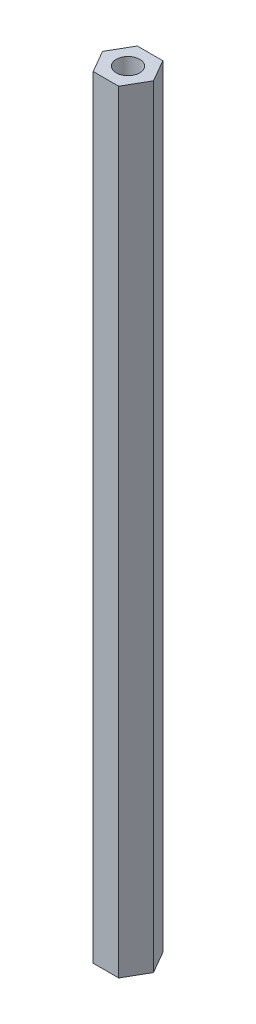
from build123d import *

# Parameters (mm, degrees)
SKETCH_1_R      = 1.6
EXTRUDE_1_DEPTH = 105


with BuildPart() as part:
    # 草图1 → 凸台-拉伸1 (new body)
    with BuildSketch(Plane(origin=(0, 0, 0), x_dir=(1, 0, 0), z_dir=(0, 1, 0))):
        Polygon((3.464101615, 0), (1.732050808, 3), (-1.732050808, 3), (-3.464101615, 0), (-1.732050808, -3), (1.732050808, -3), align=None)
        with Locations(Location((0, 0, 0), (0, 0, 270))):
            Circle(SKETCH_1_R, mode=Mode.SUBTRACT)
    extrude(amount=EXTRUDE_1_DEPTH)


solid = part.part
